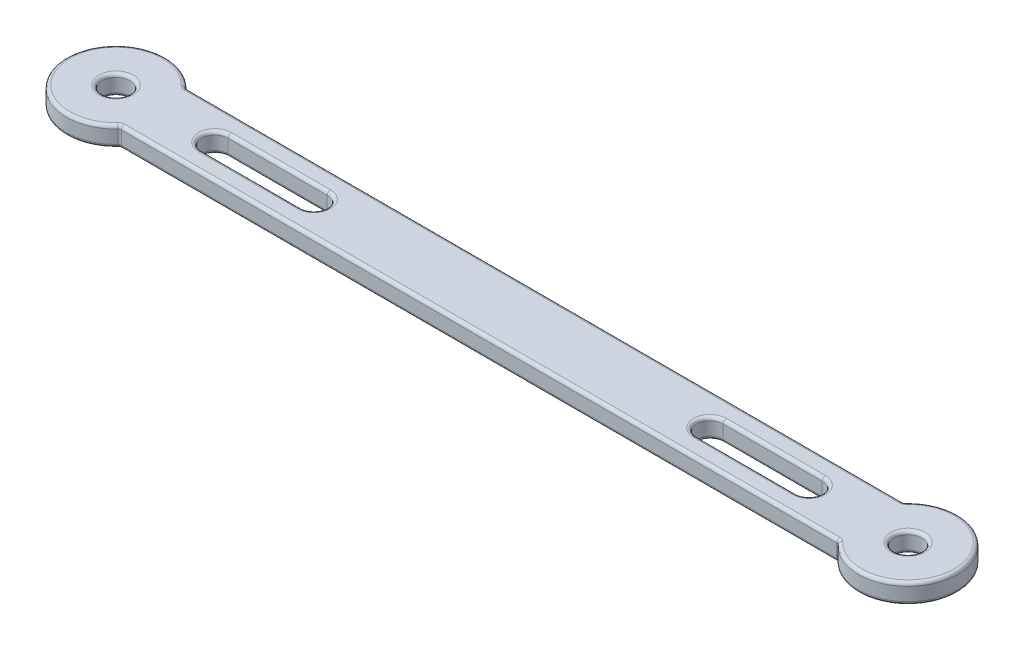
from build123d import *

# Parameters (mm, degrees)
SKETCH1_R           = 2.1
BOSS_EXTRUDE1_DEPTH = 3
CUT_EXTRUDE1_DEPTH  = 128.755626099
FILLET1_R           = 0.5


with BuildPart() as part:
    # Sketch1 → Boss-Extrude1 (new body)
    with BuildSketch(Plane(origin=(0, 0, 0), x_dir=(1, 0, 0), z_dir=(0, 1, 0))):
        with BuildLine():
            Line((5.590169944, 5), (114.409830056, 5))
            ThreePointArc((114.409830056, 5), (127.5, 0), (114.409830056, -5))
            Line((114.409830056, -5), (5.590169944, -5))
            ThreePointArc((5.590169944, -5), (-7.5, 0), (5.590169944, 5))
        make_face()
        with Locations(Location((0, 0, 0), (0, 0, 270))):
            Circle(SKETCH1_R, mode=Mode.SUBTRACT)
        with Locations(Location((120, 0, 0), (0, 0, 270))):
            Circle(SKETCH1_R, mode=Mode.SUBTRACT)
    extrude(amount=BOSS_EXTRUDE1_DEPTH)

    # Sketch2 → Cut-Extrude1 (cut, through all)
    with BuildSketch(Plane(origin=(0, 3, 0), x_dir=(1, 0, 0), z_dir=(0, 1, 0))):
        with BuildLine():
            Line((15, 2), (30, 2))
            ThreePointArc((30, 2), (32, 0), (30, -2))
            Line((30, -2), (15, -2))
            ThreePointArc((15, -2), (13, 0), (15, 2))
        make_face()
        with BuildLine():
            Line((105, 2), (90, 2))
            ThreePointArc((90, 2), (88, 0), (90, -2))
            Line((90, -2), (105, -2))
            ThreePointArc((105, -2), (107, 0), (105, 2))
        make_face()
    extrude(amount=-CUT_EXTRUDE1_DEPTH, mode=Mode.SUBTRACT)

    # Fillet1
    fillet1_edges = [part.edges().sort_by_distance(p)[0] for p in [
        (-7.5, 3, 0),
        (0, 0, -2.1),
        (0, 3, -2.1),
        (60, 3, 5),
        (120, 0, -2.1),
        (120, 3, -2.1),
        (13, 0, 0),
        (22.5, 0, -2),
        (32, 0, 0),
        (22.5, 0, 2),
        (13, 3, 0),
        (22.5, 3, 2),
        (32, 3, 0),
        (22.5, 3, -2),
        (127.5, 3, 0),
        (107, 0, 0),
        (97.5, 0, 2),
        (88, 0, 0),
        (97.5, 0, -2),
        (107, 3, 0),
        (97.5, 3, -2),
        (88, 3, 0),
        (97.5, 3, 2),
        (60, 0, 5),
        (-7.5, 0, 0),
        (60, 0, -5),
        (127.5, 0, 0),
        (60, 3, -5),
        (114.409830056, 1.5, 5),
        (5.590169944, 1.5, 5),
        (5.590169944, 1.5, -5),
        (114.409830056, 1.5, -5),
    ]]
    fillet(fillet1_edges, radius=FILLET1_R)


solid = part.part
